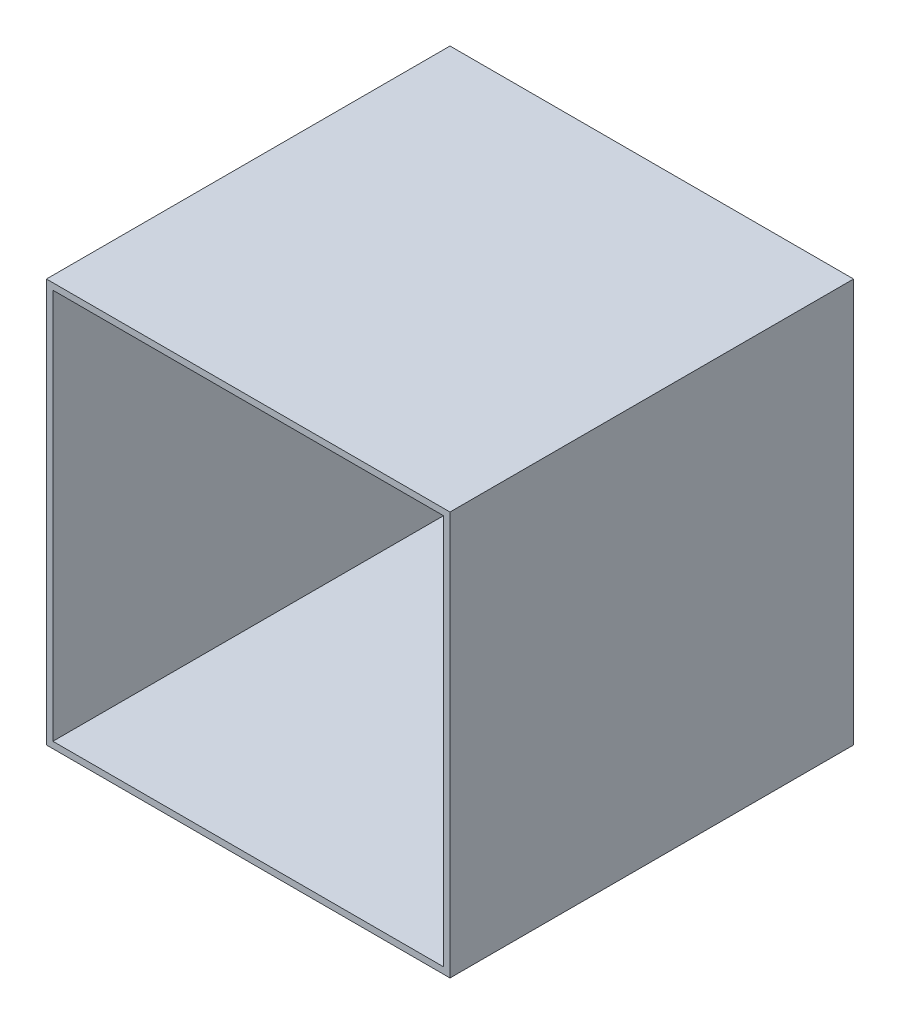
from build123d import *

# Parameters (mm, degrees)
SKETCH1_W           = 25
SKETCH1_H           = 25
SKETCH1_W_2         = 24.2
SKETCH1_H_2         = 24.2
BOSS_EXTRUDE1_DEPTH = 25


with BuildPart() as part:
    # Sketch1 → Boss-Extrude1 (new body)
    with BuildSketch(Plane.XY):
        Rectangle(SKETCH1_W, SKETCH1_H)
        Rectangle(SKETCH1_W_2, SKETCH1_H_2, mode=Mode.SUBTRACT)
    extrude(amount=BOSS_EXTRUDE1_DEPTH)


solid = part.part
